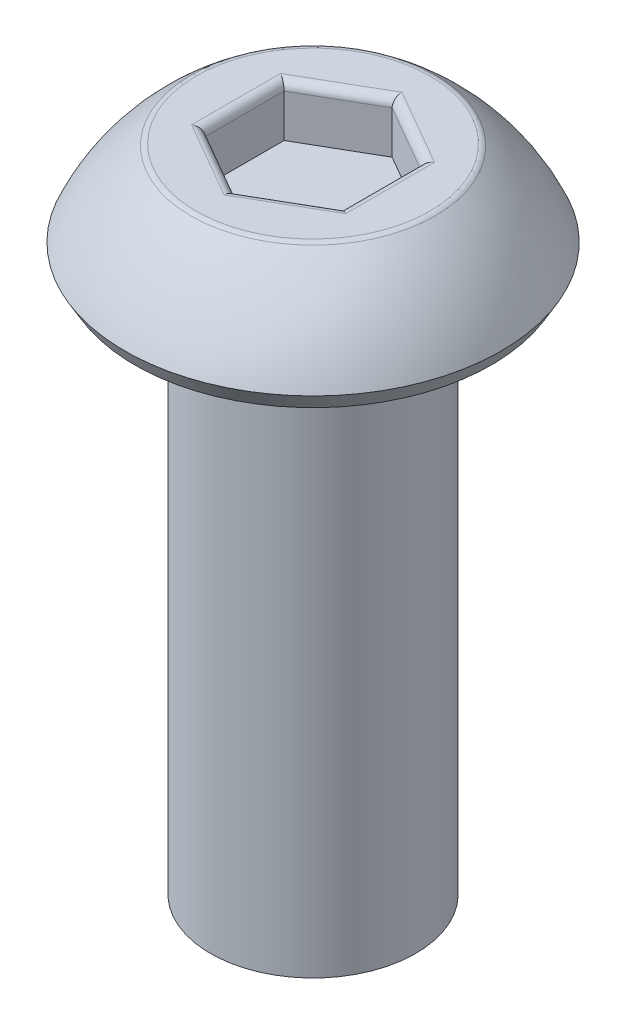
from build123d import *

# Parameters (mm, degrees)
CUT_EXTRUDE1_DEPTH = 0.75
FILLET1_R          = 0.125


with BuildPart() as part:
    # Sketch1 → Revolve1 (revolve)
    with BuildSketch(Plane(origin=(0, 0, 0), x_dir=(0, 0, -1), z_dir=(1, 0, 0)), mode=Mode.PRIVATE) as revolve1_sk:
        with BuildLine():
            Line((0, 1.5), (-1.75, 1.5))
            ThreePointArc((-1.75, 1.5), (-2.334912942, 0.942930354), (-2.75, 0.25))
            Line((-2.75, 0.25), (-2.605662433, 0))
            Line((-2.605662433, 0), (-1.5, 0))
            Line((-1.5, 0), (-1.5, -8))
            Line((-1.5, -8), (0, -8))
            Line((0, -8), (0, 1.5))
        make_face()
    revolve(revolve1_sk.sketch.rotate(Axis((0, -8, 0), (0, 1, 0)), 180), axis=Axis((0, -8, 0), (0, 1, 0)))

    # Sketch2 → Cut-Extrude1 (cut)
    with BuildSketch(Plane(origin=(0, 1.5, 0), x_dir=(1, 0, 0), z_dir=(0, 1, 0))):
        Polygon((0, 1.154700538), (-1, 0.577350269), (-1, -0.577350269), (0, -1.154700538), (1, -0.577350269), (1, 0.577350269), align=None)
    extrude(amount=-CUT_EXTRUDE1_DEPTH, mode=Mode.SUBTRACT)

    # Fillet1
    fillet1_edges = [part.edges().sort_by_distance(p)[0] for p in [
        (0.5, 1.5, -0.866025404),
        (-0.5, 1.5, -0.866025404),
        (-1, 1.5, 0),
        (-0.5, 1.5, 0.866025404),
        (0.5, 1.5, 0.866025404),
        (1, 1.5, 0),
        (0, 1.5, 1.75),
    ]]
    fillet(fillet1_edges, radius=FILLET1_R)


solid = part.part
